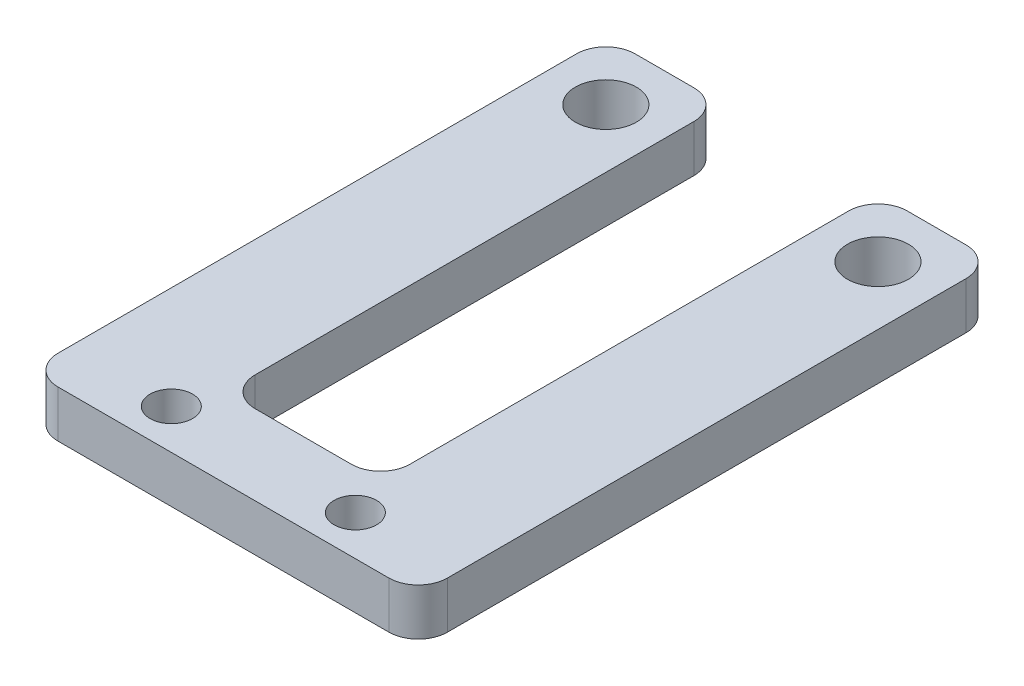
from build123d import *

# Parameters (mm, degrees)
SKETCH1_R           = 1.65
SKETCH1_R_2         = 1.15
BOSS_EXTRUDE1_DEPTH = 2.54


with BuildPart() as part:
    # Sketch1 → Boss-Extrude1 (new body)
    with BuildSketch(Plane(origin=(0, 0, 0), x_dir=(1, 0, 0), z_dir=(0, 1, 0))):
        with BuildLine():
            Line((0, -1.5875), (0, -29.6545))
            ThreePointArc((0, -29.6545), (0.464967985, -30.777032015), (1.5875, -31.242))
            Line((1.5875, -31.242), (19.4945, -31.242))
            ThreePointArc((19.4945, -31.242), (20.617032015, -30.777032015), (21.082, -29.6545))
            Line((21.082, -29.6545), (21.082, -1.5875))
            ThreePointArc((21.082, -1.5875), (20.617032015, -0.464967985), (19.4945, 0))
            Line((19.4945, 0), (16.3195, 0))
            ThreePointArc((16.3195, 0), (15.196967985, -0.464967985), (14.732, -1.5875))
            Line((14.732, -1.5875), (14.732, -25.3365))
            ThreePointArc((14.732, -25.3365), (14.267032015, -26.459032015), (13.1445, -26.924))
            Line((13.1445, -26.924), (7.9375, -26.924))
            ThreePointArc((7.9375, -26.924), (6.814967985, -26.459032015), (6.35, -25.3365))
            Line((6.35, -25.3365), (6.35, -1.5875))
            ThreePointArc((6.35, -1.5875), (5.885032015, -0.464967985), (4.7625, 0))
            Line((4.7625, 0), (1.5875, 0))
            ThreePointArc((1.5875, 0), (0.464967985, -0.464967985), (0, -1.5875))
        make_face()
        with Locations(Location((3.175, -3.175, 0), (0, 0, 270))):
            Circle(SKETCH1_R, mode=Mode.SUBTRACT)
        with Locations(Location((5.5593, -29.083, 0), (0, 0, 270))):
            Circle(SKETCH1_R_2, mode=Mode.SUBTRACT)
        with Locations(Location((15.5227, -29.083, 0), (0, 0, 90))):
            Circle(SKETCH1_R_2, mode=Mode.SUBTRACT)
        with Locations(Location((17.907, -3.175, 0), (0, 0, 90))):
            Circle(SKETCH1_R, mode=Mode.SUBTRACT)
    extrude(amount=BOSS_EXTRUDE1_DEPTH)


solid = part.part
